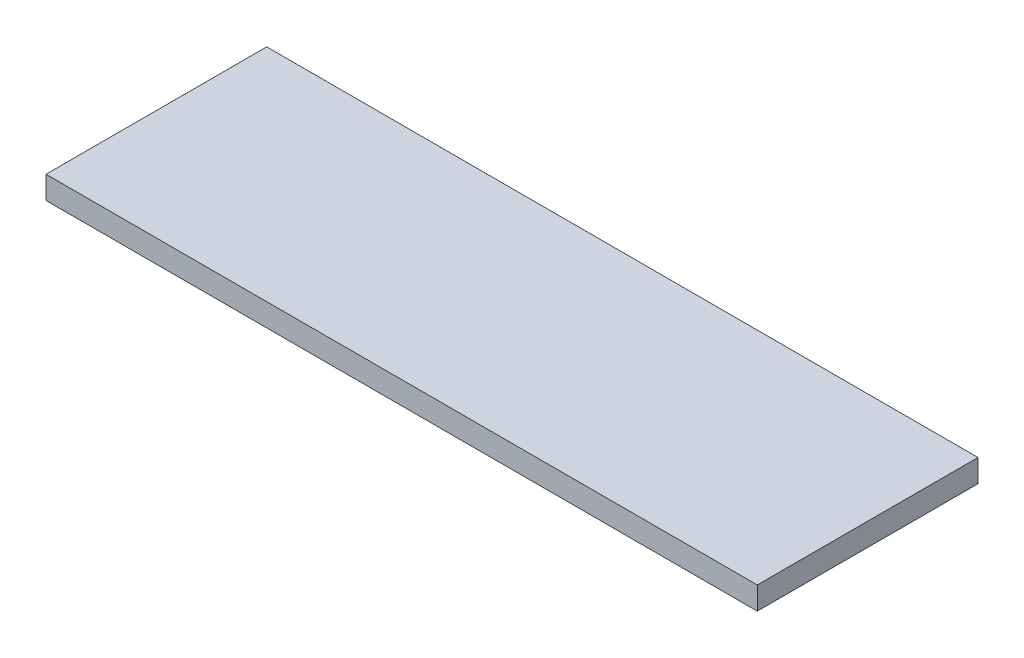
from build123d import *

# Parameters (mm, degrees)
SZKIC1_W                    = 564
SZKIC1_H                    = 175
DODANIE_WYCI_GNI_CIE1_DEPTH = 18


with BuildPart() as part:
    # Szkic1 → Dodanie-wyciągnięcie1 (new body)
    with BuildSketch(Plane(origin=(0, 0, 0), x_dir=(1, 0, 0), z_dir=(0, 1, 0))):
        with Locations((-282, 87.5)):
            Rectangle(SZKIC1_W, SZKIC1_H)
    extrude(amount=DODANIE_WYCI_GNI_CIE1_DEPTH)


solid = part.part
